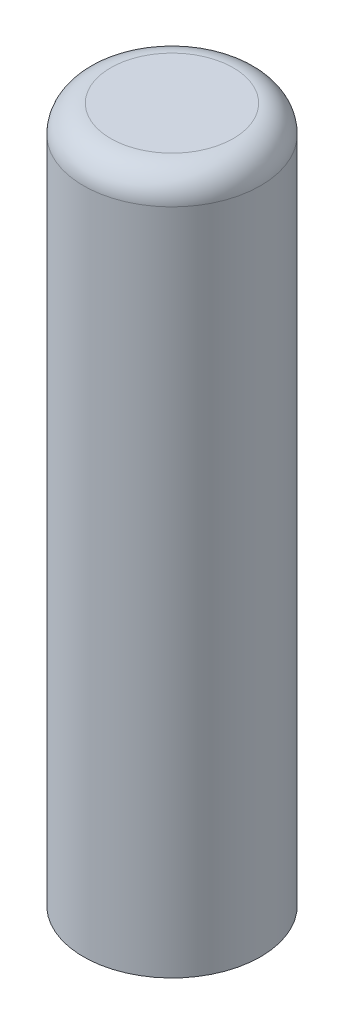
from build123d import *

# Parameters (mm, degrees)
CONG_1_R = 4


with BuildPart() as part:
    # Esquisse1 → Révolution1 (revolve)
    with BuildSketch(Plane.XY, mode=Mode.PRIVATE) as r_volution1_sk:
        Polygon((0, 0), (10, 0), (10, -99), (9, -99), (9, -100), (3, -100), (3, -10), (0, -10), align=None)
        Polygon((10.1, 0.1), (10.1, -99), (13, -99), (13, 3), (0, 3), (0, 0.1), align=None)
    revolve(r_volution1_sk.sketch.rotate(Axis((0, -10, 0), (0, -1, 0)), 180), axis=Axis((0, -10, 0), (0, -1, 0)))

    # Congé1
    cong_1_edges = [part.edges().sort_by_distance(p)[0] for p in [
        (13, 3, 0),
    ]]
    fillet(cong_1_edges, radius=CONG_1_R)


solid = part.part
